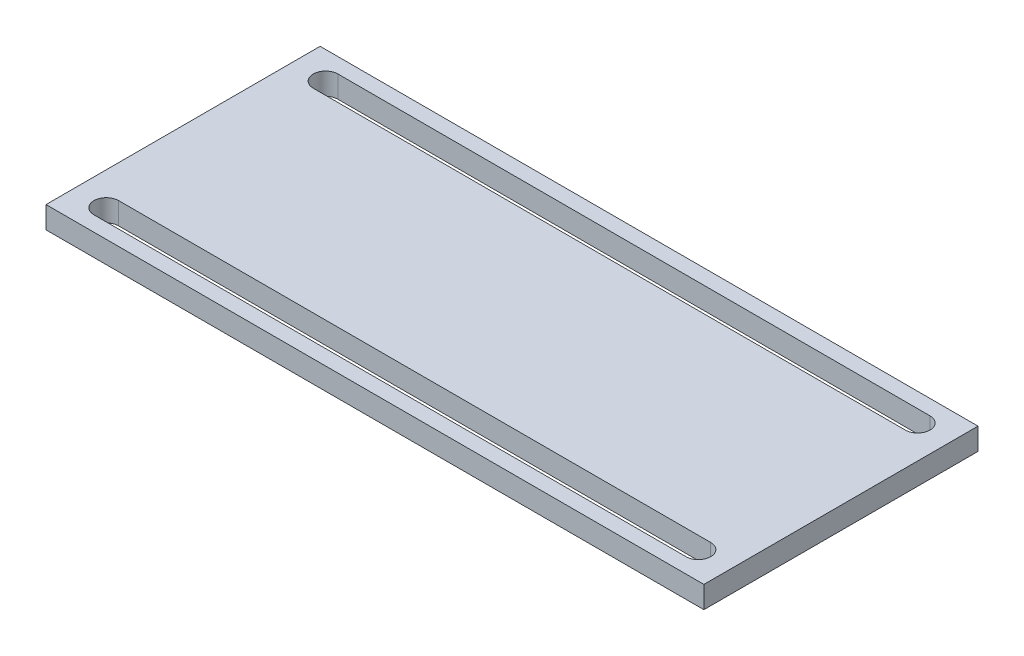
from build123d import *

# Parameters (mm, degrees)
SKETCH1_W           = 120
SKETCH1_H           = 50
BOSS_EXTRUDE1_DEPTH = 4
CUT_EXTRUDE1_DEPTH  = 66.122960621


with BuildPart() as part:
    # Sketch1 → Boss-Extrude1 (new body)
    with BuildSketch(Plane(origin=(0, 0, 0), x_dir=(1, 0, 0), z_dir=(0, 1, 0))):
        Rectangle(SKETCH1_W, SKETCH1_H)
    extrude(amount=BOSS_EXTRUDE1_DEPTH)

    # Sketch2 → Cut-Extrude1 (cut, through all)
    with BuildSketch(Plane(origin=(0, 4, 0), x_dir=(1, 0, 0), z_dir=(0, 1, 0))):
        with BuildLine():
            Line((-54, 22.25), (54, 22.25))
            ThreePointArc((54, 22.25), (56.25, 20), (54, 17.75))
            Line((54, 17.75), (-54, 17.75))
            ThreePointArc((-54, 17.75), (-56.25, 20), (-54, 22.25))
        make_face()
        with BuildLine():
            Line((-54, -17.75), (54, -17.75))
            ThreePointArc((54, -17.75), (56.25, -20), (54, -22.25))
            Line((54, -22.25), (-54, -22.25))
            ThreePointArc((-54, -22.25), (-56.25, -20), (-54, -17.75))
        make_face()
    extrude(amount=-CUT_EXTRUDE1_DEPTH, mode=Mode.SUBTRACT)


solid = part.part
